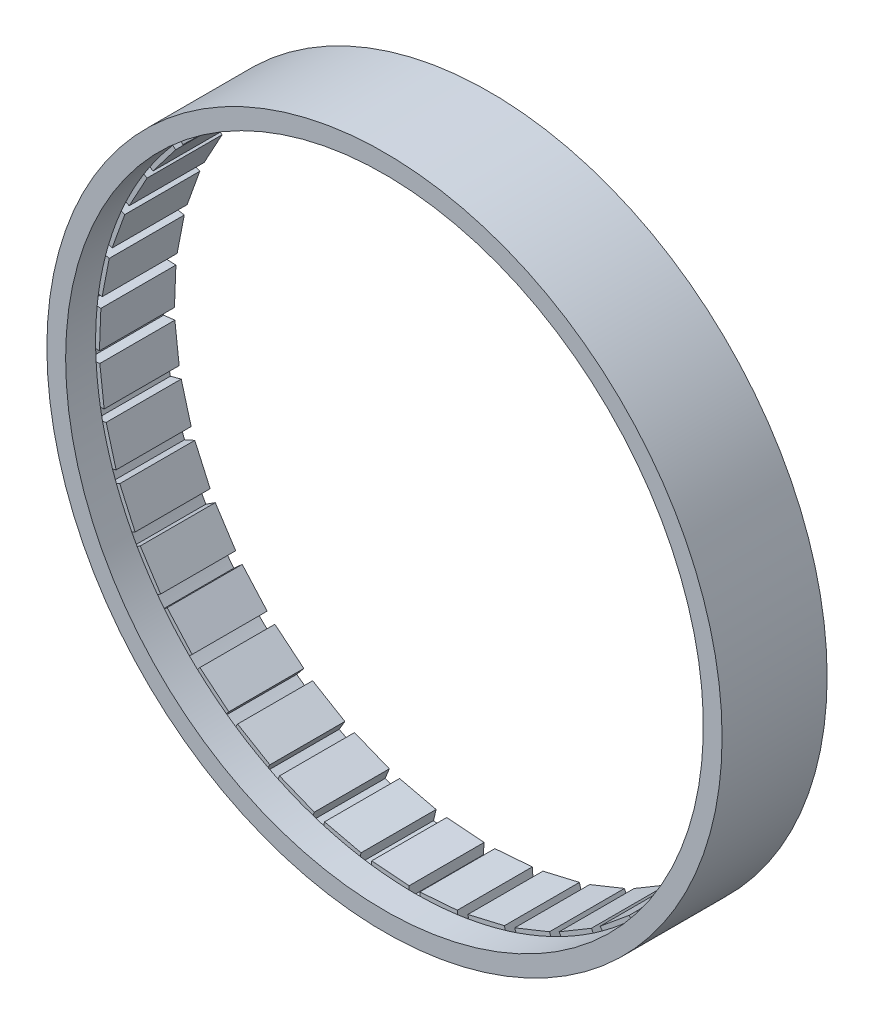
from build123d import *

# Parameters (mm, degrees)
BOSS_EXTRUDE1_DEPTH = 10


with BuildPart() as part:
    # Sketch2 → Revolve1 (revolve)
    with BuildSketch(Plane(origin=(0, 0, 0), x_dir=(0, 0, -1), z_dir=(1, 0, 0)), mode=Mode.PRIVATE) as revolve1_sk:
        Polygon((0, 45), (-14, 45), (-14, 42.5), (-10, 42.5), (-10, 43.5), (0, 43.5), align=None)
    revolve(revolve1_sk.sketch.rotate(Axis((0, 0, 0), (0, 0, 1)), 90), axis=Axis((0, 0, 0), (0, 0, 1)))

    # Sketch4 → Boss-Extrude1 (add)
    with BuildSketch(Plane(origin=(0, 0, 0), x_dir=(-1, 0, 0), z_dir=(0, 0, -1))):
        with BuildLine():
            Line((-2.5, 41.928101501), (2.5, 41.928101501))
            Line((2.5, 41.928101501), (2.5, 43.428101501))
            ThreePointArc((2.5, 43.428101501), (0, 43.5), (-2.5, 43.428101501))
            Line((-2.5, 43.428101501), (-2.5, 41.928101501))
        make_face()
        with BuildLine():
            Line((3.929593623, 41.81834513), (4.15856755, 43.300765766))
            ThreePointArc((4.15856755, 43.300765766), (6.640243864, 42.990198434), (9.099969669, 42.537519345))
            Line((9.099969669, 42.537519345), (8.870995742, 41.055098709))
            Line((8.870995742, 41.055098709), (3.929593623, 41.81834513))
        make_face()
        with BuildLine():
            Line((10.267080903, 40.728402193), (10.719661801, 42.158496782))
            ThreePointArc((10.719661801, 42.158496782), (13.124846039, 41.472743054), (15.486643761, 40.649893789))
            Line((15.486643761, 40.649893789), (15.034062863, 39.2197992))
            Line((15.034062863, 39.2197992), (10.267080903, 40.728402193))
        make_face()
        with BuildLine():
            Line((16.363916508, 38.683820029), (17.029496265, 40.028068364))
            ThreePointArc((17.029496265, 40.028068364), (19.301812947, 38.983201728), (21.510324049, 37.809469175))
            Line((21.510324049, 37.809469175), (20.844744293, 36.465220839))
            Line((20.844744293, 36.465220839), (16.363916508, 38.683820029))
        make_face()
        with BuildLine():
            Line((22.077195779, 35.73252191), (22.94017377, 36.959415951))
            ThreePointArc((22.94017377, 36.959415951), (25.02636172, 35.579927193), (27.029820573, 34.08282265))
            Line((27.029820573, 34.08282265), (26.166842583, 32.855928609))
            Line((26.166842583, 32.855928609), (22.077195779, 35.73252191))
        make_face()
        with BuildLine():
            Line((27.273004293, 31.943683762), (28.313153045, 33.024466153))
            ThreePointArc((28.313153045, 33.024466153), (30.164313784, 31.342689322), (31.915761013, 29.557303649))
            Line((31.915761013, 29.557303649), (30.875612261, 28.476521258))
            Line((30.875612261, 28.476521258), (27.273004293, 31.943683762))
        make_face()
        with BuildLine():
            Line((31.829556703, 27.406112742), (33.022496009, 28.315450858))
            ThreePointArc((33.022496009, 28.315450858), (34.5952399, 26.370805377), (36.053623064, 24.338986502))
            Line((36.053623064, 24.338986502), (34.860683757, 23.429648385))
            Line((34.860683757, 23.429648385), (31.829556703, 27.406112742))
        make_face()
        with BuildLine():
            Line((35.64005128, 22.226165667), (36.957819656, 22.942745395))
            ThreePointArc((36.957819656, 22.942745395), (38.215282915, 20.780812105), (39.346418749, 18.55018414))
            Line((39.346418749, 18.55018414), (38.028650373, 17.833604412))
            Line((38.028650373, 17.833604412), (35.64005128, 22.226165667))
        make_face()
        with BuildLine():
            Line((38.615173263, 16.525256107), (40.026883334, 17.032281425))
            ThreePointArc((40.026883334, 17.032281425), (40.939592087, 14.703734211), (41.716967727, 12.326581185))
            Line((41.716967727, 12.326581185), (40.305257655, 11.819555867))
            Line((40.305257655, 11.819555867), (38.615173263, 16.525256107))
        make_face()
        with BuildLine():
            Line((40.685188313, 10.43700855), (42.157750793, 10.722595214))
            ThreePointArc((42.157750793, 10.722595214), (42.70431192, 8.282013249), (43.109706338, 5.814053614))
            Line((43.109706338, 5.814053614), (41.637143858, 5.52846695))
            Line((41.637143858, 5.52846695), (40.685188313, 10.43700855))
        make_face()
        with BuildLine():
            Line((41.801577032, 4.104126359), (43.300476303, 4.161580459))
            ThreePointArc((43.300476303, 4.161580459), (43.468078876, 1.666168916), (43.491989972, -0.834750446))
            Line((43.491989972, -0.834750446), (41.9930907, -0.892204547))
            Line((41.9930907, -0.892204547), (41.801577032, 4.104126359))
        make_face()
        with BuildLine():
            Line((41.938172214, -2.324953076), (43.428275349, -2.496978214))
            ThreePointArc((43.428275349, -2.496978214), (43.212990905, -4.988729005), (42.854858222, -7.463988663))
            Line((42.854858222, -7.463988663), (41.364755087, -7.291963525))
            Line((41.364755087, -7.291963525), (41.938172214, -2.324953076))
        make_face()
        with BuildLine():
            Line((41.091772186, -8.699537581), (42.538152429, -9.097009835))
            ThreePointArc((42.538152429, -9.097009835), (41.945027052, -11.526695346), (41.213244918, -13.918277312))
            Line((41.213244918, -13.918277312), (39.766864675, -13.520805059))
            Line((39.766864675, -13.520805059), (41.091772186, -8.699537581))
        make_face()
        with BuildLine():
            Line((39.282215845, -14.870212299), (40.650971269, -15.483815255))
            ThreePointArc((40.650971269, -15.483815255), (39.693907317, -17.794485717), (38.605628084, -20.046333337))
            Line((38.605628084, -20.046333337), (37.236872659, -19.432730381))
            Line((37.236872659, -19.432730381), (39.282215845, -14.870212299))
        make_face()
        with BuildLine():
            Line((36.551917658, -20.692341844), (37.810965798, -21.507693169))
            ThreePointArc((37.810965798, -21.507693169), (36.512396037, -23.645188425), (35.093128048, -25.7045203))
            Line((35.093128048, -25.7045203), (33.834079908, -24.889168975))
            Line((33.834079908, -24.889168975), (36.551917658, -20.692341844))
        make_face()
        with BuildLine():
            Line((32.964873502, -26.029460434), (34.084703335, -27.027448984))
            ThreePointArc((34.084703335, -27.027448984), (32.47506514, -28.941667957), (30.758074834, -30.760215092))
            Line((30.758074834, -30.760215092), (29.638245001, -29.762226542))
            Line((29.638245001, -29.762226542), (32.964873502, -26.029460434))
        make_face()
        with BuildLine():
            Line((28.605160651, -30.756470533), (29.559524314, -31.913704303))
            ThreePointArc((29.559524314, -31.913704303), (27.676546241, -33.559779322), (25.702078415, -35.094916514))
            Line((25.702078415, -35.094916514), (24.747714752, -33.937682744))
            Line((24.747714752, -33.937682744), (28.605160651, -30.756470533))
        make_face()
        with BuildLine():
            Line((23.574967078, -34.762575031), (24.341495098, -36.051929441))
            ThreePointArc((24.341495098, -36.051929441), (22.229312556, -37.391277904), (20.043647063, -38.607022838))
            Line((20.043647063, -38.607022838), (19.277119043, -37.317668428))
            Line((19.277119043, -37.317668428), (23.574967078, -34.762575031))
        make_face()
        with BuildLine():
            Line((17.992196259, -37.953874233), (18.552921867, -39.345127909))
            ThreePointArc((18.552921867, -39.345127909), (16.261042625, -40.346356623), (13.915409611, -41.214213269))
            Line((13.915409611, -41.214213269), (13.354684003, -39.822959592))
            Line((13.354684003, -39.822959592), (17.992196259, -37.953874233))
        make_face()
        with BuildLine():
            Line((11.987703608, -40.255566791), (12.329483872, -41.716109927))
            ThreePointArc((12.329483872, -41.716109927), (9.911627637, -42.355750939), (7.461006752, -42.855377472))
            Line((7.461006752, -42.855377472), (7.119226489, -41.394834336))
            Line((7.119226489, -41.394834336), (11.987703608, -40.255566791))
        make_face()
        with BuildLine():
            Line((5.702229346, -41.613702983), (5.817053225, -43.109301685))
            ThreePointArc((5.817053225, -43.109301685), (3.329892498, -43.372362351), (0.831724219, -43.492047949))
            Line((0.831724219, -43.492047949), (0.71690034, -41.996449248))
            Line((0.71690034, -41.996449248), (5.702229346, -41.613702983))
        make_face()
        with BuildLine():
            Line((-0.71690034, -41.996449248), (-0.831724219, -43.492047949))
            ThreePointArc((-0.831724219, -43.492047949), (-3.329892498, -43.372362351), (-5.817053225, -43.109301685))
            Line((-5.817053225, -43.109301685), (-5.702229346, -41.613702983))
            Line((-5.702229346, -41.613702983), (-0.71690034, -41.996449248))
        make_face()
        with BuildLine():
            Line((-7.119226489, -41.394834336), (-7.461006752, -42.855377472))
            ThreePointArc((-7.461006752, -42.855377472), (-9.911627637, -42.355750939), (-12.329483872, -41.716109927))
            Line((-12.329483872, -41.716109927), (-11.987703608, -40.255566791))
            Line((-11.987703608, -40.255566791), (-7.119226489, -41.394834336))
        make_face()
        with BuildLine():
            Line((-13.354684003, -39.822959592), (-13.915409611, -41.214213269))
            ThreePointArc((-13.915409611, -41.214213269), (-16.261042625, -40.346356623), (-18.552921867, -39.345127909))
            Line((-18.552921867, -39.345127909), (-17.992196259, -37.953874233))
            Line((-17.992196259, -37.953874233), (-13.354684003, -39.822959592))
        make_face()
        with BuildLine():
            Line((-19.277119043, -37.317668428), (-20.043647063, -38.607022838))
            ThreePointArc((-20.043647063, -38.607022838), (-22.229312556, -37.391277904), (-24.341495098, -36.051929441))
            Line((-24.341495098, -36.051929441), (-23.574967078, -34.762575031))
            Line((-23.574967078, -34.762575031), (-19.277119043, -37.317668428))
        make_face()
        with BuildLine():
            Line((-24.747714752, -33.937682744), (-25.702078415, -35.094916514))
            ThreePointArc((-25.702078415, -35.094916514), (-27.676546241, -33.559779322), (-29.559524314, -31.913704303))
            Line((-29.559524314, -31.913704303), (-28.605160651, -30.756470533))
            Line((-28.605160651, -30.756470533), (-24.747714752, -33.937682744))
        make_face()
        with BuildLine():
            Line((-29.638245001, -29.762226542), (-30.758074834, -30.760215092))
            ThreePointArc((-30.758074834, -30.760215092), (-32.47506514, -28.941667957), (-34.084703335, -27.027448984))
            Line((-34.084703335, -27.027448984), (-32.964873502, -26.029460434))
            Line((-32.964873502, -26.029460434), (-29.638245001, -29.762226542))
        make_face()
        with BuildLine():
            Line((-33.834079908, -24.889168975), (-35.093128048, -25.7045203))
            ThreePointArc((-35.093128048, -25.7045203), (-36.512396037, -23.645188425), (-37.810965798, -21.507693169))
            Line((-37.810965798, -21.507693169), (-36.551917658, -20.692341844))
            Line((-36.551917658, -20.692341844), (-33.834079908, -24.889168975))
        make_face()
        with BuildLine():
            Line((-37.236872659, -19.432730381), (-38.605628084, -20.046333337))
            ThreePointArc((-38.605628084, -20.046333337), (-39.693907317, -17.794485717), (-40.650971269, -15.483815255))
            Line((-40.650971269, -15.483815255), (-39.282215845, -14.870212299))
            Line((-39.282215845, -14.870212299), (-37.236872659, -19.432730381))
        make_face()
        with BuildLine():
            Line((-39.766864675, -13.520805059), (-41.213244918, -13.918277312))
            ThreePointArc((-41.213244918, -13.918277312), (-41.945027052, -11.526695346), (-42.538152429, -9.097009835))
            Line((-42.538152429, -9.097009835), (-41.091772186, -8.699537581))
            Line((-41.091772186, -8.699537581), (-39.766864675, -13.520805059))
        make_face()
        with BuildLine():
            Line((-41.364755087, -7.291963525), (-42.854858222, -7.463988663))
            ThreePointArc((-42.854858222, -7.463988663), (-43.212990905, -4.988729005), (-43.428275349, -2.496978214))
            Line((-43.428275349, -2.496978214), (-41.938172214, -2.324953076))
            Line((-41.938172214, -2.324953076), (-41.364755087, -7.291963525))
        make_face()
        with BuildLine():
            Line((-41.9930907, -0.892204547), (-43.491989972, -0.834750446))
            ThreePointArc((-43.491989972, -0.834750446), (-43.468078876, 1.666168916), (-43.300476303, 4.161580459))
            Line((-43.300476303, 4.161580459), (-41.801577032, 4.104126359))
            Line((-41.801577032, 4.104126359), (-41.9930907, -0.892204547))
        make_face()
        with BuildLine():
            Line((-41.637143858, 5.52846695), (-43.109706338, 5.814053614))
            ThreePointArc((-43.109706338, 5.814053614), (-42.70431192, 8.282013249), (-42.157750793, 10.722595214))
            Line((-42.157750793, 10.722595214), (-40.685188313, 10.43700855))
            Line((-40.685188313, 10.43700855), (-41.637143858, 5.52846695))
        make_face()
        with BuildLine():
            Line((-40.305257655, 11.819555867), (-41.716967727, 12.326581185))
            ThreePointArc((-41.716967727, 12.326581185), (-40.939592087, 14.703734211), (-40.026883334, 17.032281425))
            Line((-40.026883334, 17.032281425), (-38.615173263, 16.525256107))
            Line((-38.615173263, 16.525256107), (-40.305257655, 11.819555867))
        make_face()
        with BuildLine():
            Line((-38.028650373, 17.833604412), (-39.346418749, 18.55018414))
            ThreePointArc((-39.346418749, 18.55018414), (-38.215282915, 20.780812105), (-36.957819656, 22.942745395))
            Line((-36.957819656, 22.942745395), (-35.64005128, 22.226165667))
            Line((-35.64005128, 22.226165667), (-38.028650373, 17.833604412))
        make_face()
        with BuildLine():
            Line((-34.860683757, 23.429648385), (-36.053623064, 24.338986502))
            ThreePointArc((-36.053623064, 24.338986502), (-34.5952399, 26.370805377), (-33.022496009, 28.315450858))
            Line((-33.022496009, 28.315450858), (-31.829556703, 27.406112742))
            Line((-31.829556703, 27.406112742), (-34.860683757, 23.429648385))
        make_face()
        with BuildLine():
            Line((-30.875612261, 28.476521258), (-31.915761013, 29.557303649))
            ThreePointArc((-31.915761013, 29.557303649), (-30.164313784, 31.342689322), (-28.313153045, 33.024466153))
            Line((-28.313153045, 33.024466153), (-27.273004293, 31.943683762))
            Line((-27.273004293, 31.943683762), (-30.875612261, 28.476521258))
        make_face()
        with BuildLine():
            Line((-26.166842583, 32.855928609), (-27.029820573, 34.08282265))
            ThreePointArc((-27.029820573, 34.08282265), (-25.02636172, 35.579927193), (-22.94017377, 36.959415951))
            Line((-22.94017377, 36.959415951), (-22.077195779, 35.73252191))
            Line((-22.077195779, 35.73252191), (-26.166842583, 32.855928609))
        make_face()
        with BuildLine():
            Line((-20.844744293, 36.465220839), (-21.510324049, 37.809469175))
            ThreePointArc((-21.510324049, 37.809469175), (-19.301812947, 38.983201728), (-17.029496265, 40.028068364))
            Line((-17.029496265, 40.028068364), (-16.363916508, 38.683820029))
            Line((-16.363916508, 38.683820029), (-20.844744293, 36.465220839))
        make_face()
        with BuildLine():
            Line((-15.034062863, 39.2197992), (-15.486643761, 40.649893789))
            ThreePointArc((-15.486643761, 40.649893789), (-13.124846039, 41.472743054), (-10.719661801, 42.158496782))
            Line((-10.719661801, 42.158496782), (-10.267080903, 40.728402193))
            Line((-10.267080903, 40.728402193), (-15.034062863, 39.2197992))
        make_face()
        with BuildLine():
            Line((-8.870995742, 41.055098709), (-9.099969669, 42.537519345))
            ThreePointArc((-9.099969669, 42.537519345), (-6.640243864, 42.990198434), (-4.15856755, 43.300765766))
            Line((-4.15856755, 43.300765766), (-3.929593623, 41.81834513))
            Line((-3.929593623, 41.81834513), (-8.870995742, 41.055098709))
        make_face()
    extrude(amount=-BOSS_EXTRUDE1_DEPTH)


solid = part.part
